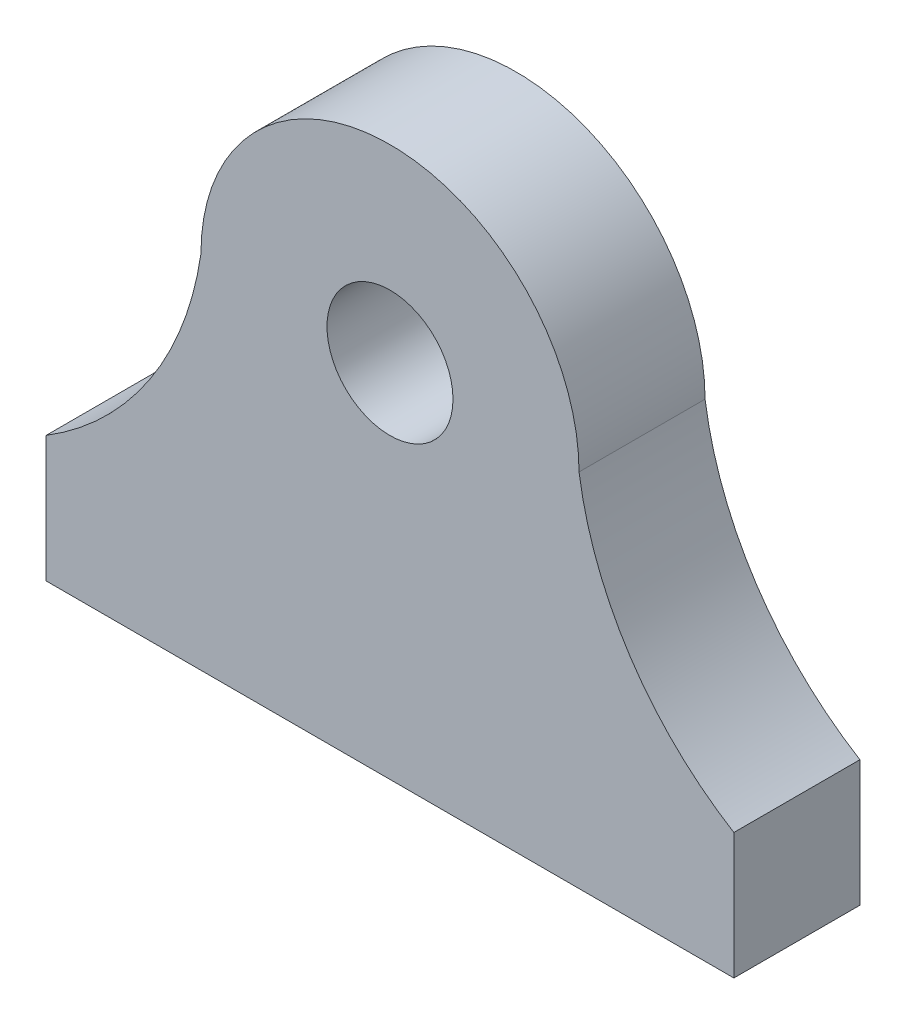
from build123d import *

# Parameters (mm, degrees)
ESBO_O1_R                = 5
RESSALTO_EXTRUS_O1_DEPTH = 10


with BuildPart() as part:
    # Esboço1 → Ressalto-extrusão1 (new body)
    with BuildSketch(Plane.XY):
        with BuildLine():
            Line((-27.286144523, -18.629908028), (-27.286144523, -28.629908028))
            Line((-27.286144523, -28.629908028), (27.286144523, -28.629908028))
            Line((27.286144523, -28.629908028), (27.286144523, -18.629908028))
            ThreePointArc((27.286144523, -18.629908028), (19.069349751, -10.682542862), (15, 0))
            ThreePointArc((15, 0), (0, 15), (-15, 0))
            ThreePointArc((-15, 0), (-19.069349751, -10.682542862), (-27.286144523, -18.629908028))
        make_face()
        Circle(ESBO_O1_R, mode=Mode.SUBTRACT)
    extrude(amount=RESSALTO_EXTRUS_O1_DEPTH)


solid = part.part
